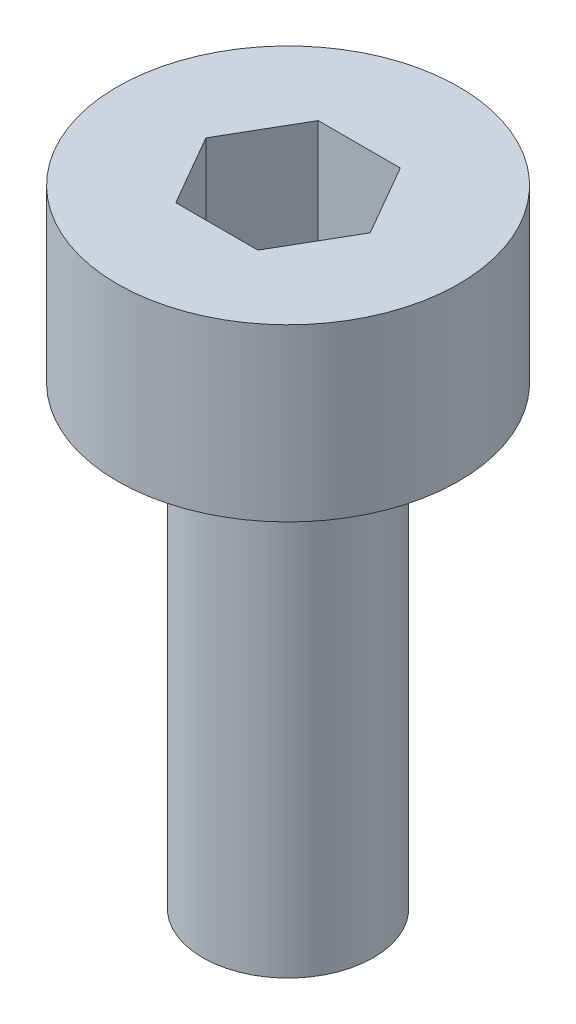
from build123d import *

# Parameters (mm, degrees)
SKETCH1_R           = 1.5
BOSS_EXTRUDE1_DEPTH = 8
SKETCH2_R           = 3
BOSS_EXTRUDE2_DEPTH = 3
CUT_EXTRUDE1_DEPTH  = 2


with BuildPart() as part:
    # Sketch1 → Boss-Extrude1 (new body)
    with BuildSketch(Plane(origin=(0, 0, 0), x_dir=(1, 0, 0), z_dir=(0, 1, 0))):
        with Locations(Location((0, 0, 0), (0, 0, 270))):
            Circle(SKETCH1_R)
    extrude(amount=BOSS_EXTRUDE1_DEPTH)

    # Sketch2 → Boss-Extrude2 (add)
    with BuildSketch(Plane(origin=(0, 8, 0), x_dir=(1, 0, 0), z_dir=(0, 1, 0))):
        with Locations(Location((0, 0, 0), (0, 0, 270))):
            Circle(SKETCH2_R)
    extrude(amount=BOSS_EXTRUDE2_DEPTH)

    # Sketch3 → Cut-Extrude1 (cut)
    with BuildSketch(Plane(origin=(0, 11, 0), x_dir=(1, 0, 0), z_dir=(0, 1, 0))):
        Polygon((1.443375673, 0), (0.721687836, 1.25), (-0.721687836, 1.25), (-1.443375673, 0), (-0.721687836, -1.25), (0.721687836, -1.25), align=None)
    extrude(amount=-CUT_EXTRUDE1_DEPTH, mode=Mode.SUBTRACT)


solid = part.part
